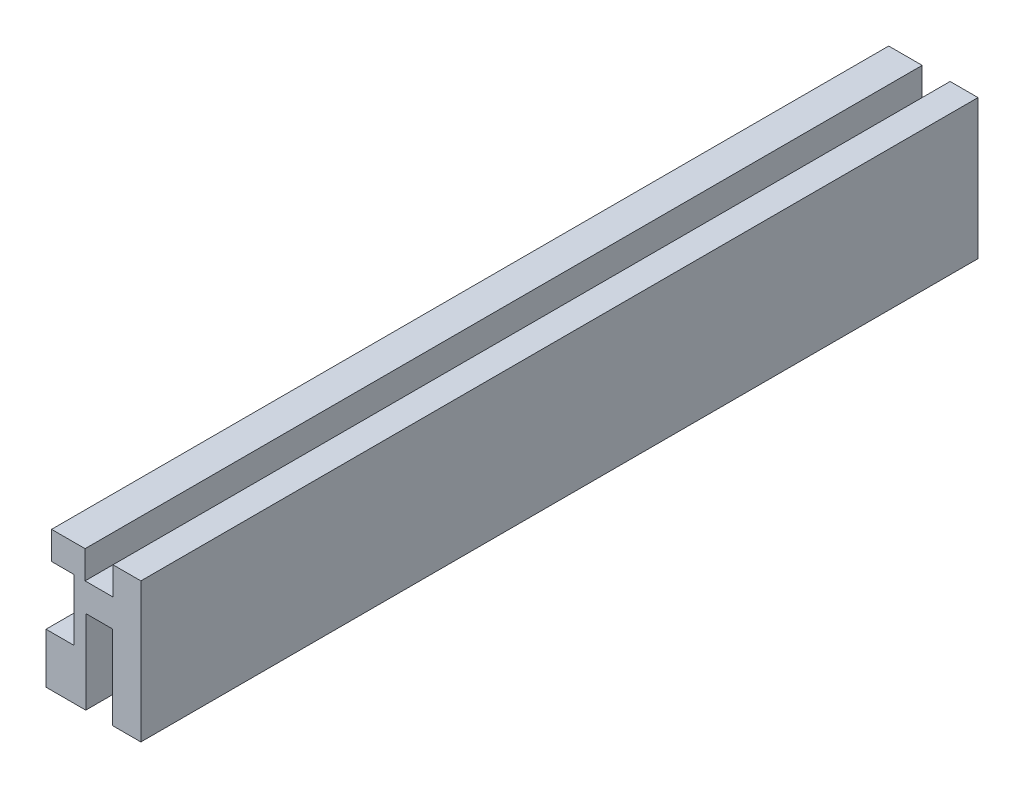
from build123d import *

# Parameters (mm, degrees)
BOSS_EXTRUDE1_DEPTH = 300


with BuildPart() as part:
    # Sketch1 → Boss-Extrude1 (new body)
    with BuildSketch(Plane.XY):
        Polygon((15, 25), (5, 25), (5, 15), (-5, 15), (-5, 25), (-17, 25), (-17, 15), (-9, 15), (-9, -7), (-19, -7), (-19, -25), (-4.75, -25), (-4.75, 5), (4.75, 5), (4.75, -25), (15, -25), align=None)
    extrude(amount=BOSS_EXTRUDE1_DEPTH)


solid = part.part
